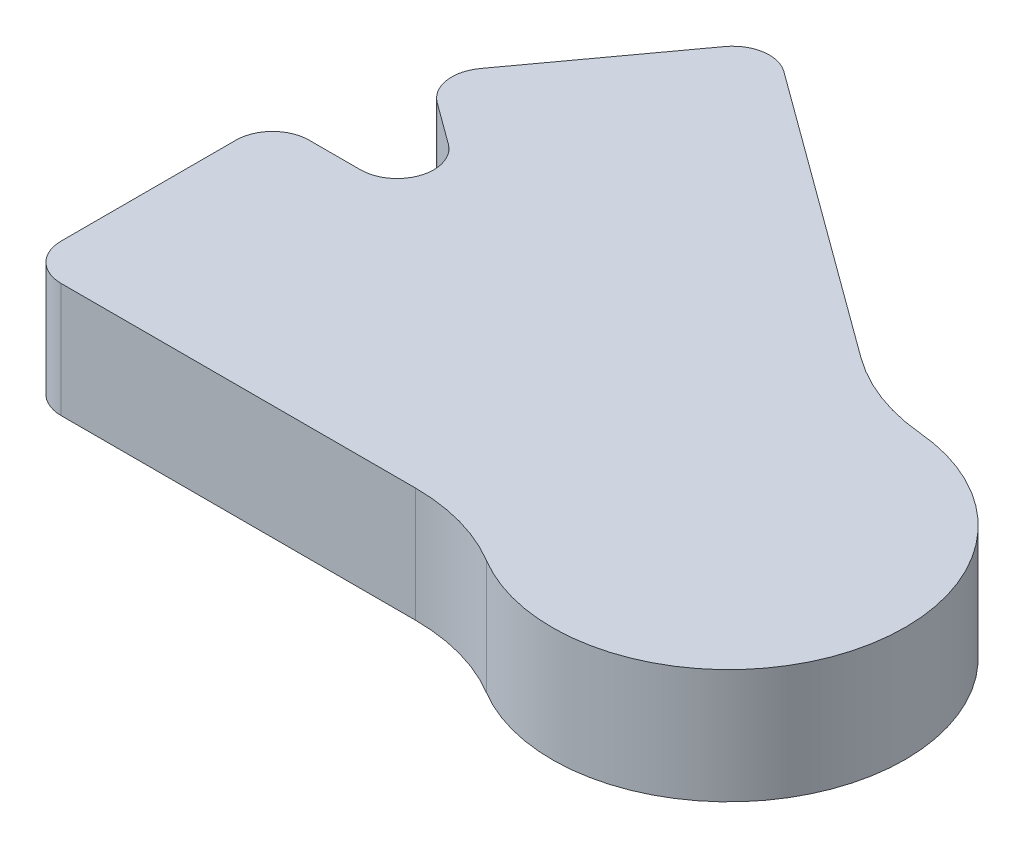
from build123d import *

# Parameters (mm, degrees)
BOSS_EXTRUDE1_DEPTH = 9.525


with BuildPart() as part:
    # Sketch1 → Boss-Extrude1 (new body)
    with BuildSketch(Plane(origin=(0, 0, 0), x_dir=(1, 0, 0), z_dir=(0, 1, 0))):
        with BuildLine():
            Line((-43.253160589, 22.606536767), (-34.672708234, 34.346684109))
            ThreePointArc((-34.672708234, 34.346684109), (-32.680204005, 35.559969312), (-30.413368559, 35.008978255))
            Line((-30.413368559, 35.008978255), (-6.614426983, 17.615185966))
            ThreePointArc((-6.614426983, 17.615185966), (-2.849545496, 15.578373329), (1.322663433, 14.621497696))
            ThreePointArc((1.322663433, 14.621497696), (13.956234084, -4.556441994), (-7.559797873, -12.585193267))
            ThreePointArc((-7.559797873, -12.585193267), (-11.492870345, -10.89585042), (-15.734319794, -10.31875))
            Line((-15.734319794, -10.31875), (-45.212, -10.31875))
            ThreePointArc((-45.212, -10.31875), (-47.367261469, -9.426011469), (-48.26, -7.27075))
            Line((-48.26, -7.27075), (-48.26, 7.27075))
            ThreePointArc((-48.26, 7.27075), (-47.367261469, 9.426011469), (-45.212, 10.31875))
            Line((-45.212, 10.31875), (-40.94192183, 10.31875))
            ThreePointArc((-40.94192183, 10.31875), (-38.044433785, 12.420775884), (-39.143399065, 15.82756691))
            Line((-39.143399065, 15.82756691), (-42.590866444, 18.347197092))
            ThreePointArc((-42.590866444, 18.347197092), (-43.804151646, 20.339701321), (-43.253160589, 22.606536767))
        make_face()
    extrude(amount=-BOSS_EXTRUDE1_DEPTH)


solid = part.part
